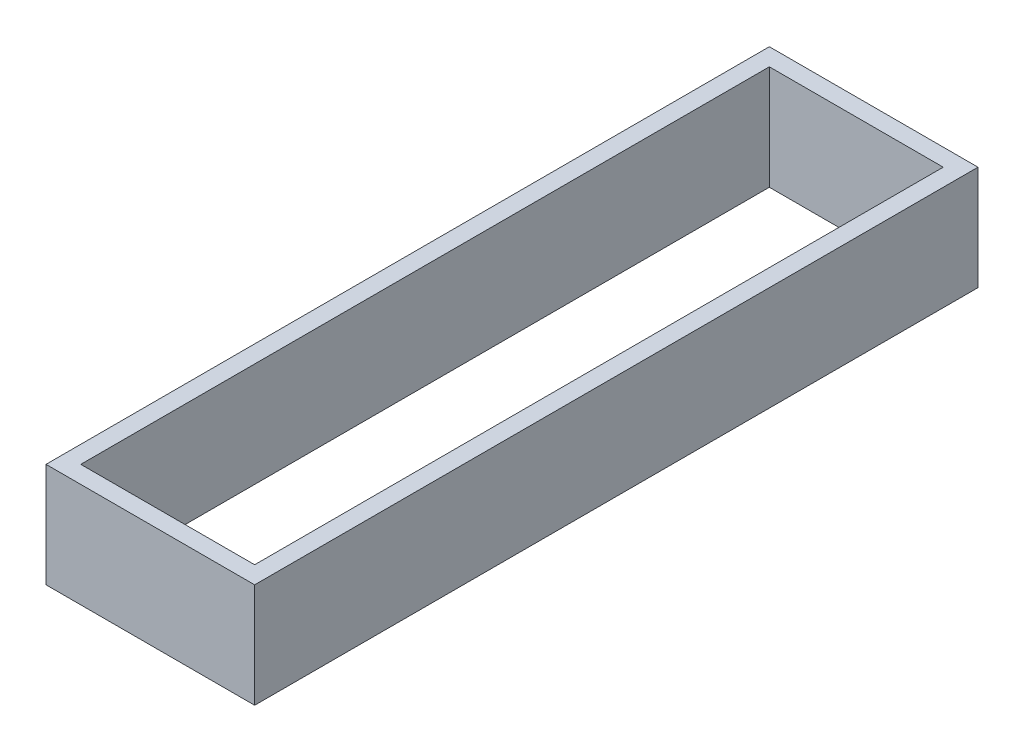
from build123d import *

# Parameters (mm, degrees)
SKETCH_1_W      = 60
SKETCH_1_H      = 208
SKETCH_1_W_2    = 50
SKETCH_1_H_2    = 198
EXTRUDE_1_DEPTH = 30


with BuildPart() as part:
    # ｽｹｯﾁ1 → ﾎﾞｽ - 押し出し1 (new body)
    with BuildSketch(Plane(origin=(0, 0, 0), x_dir=(1, 0, 0), z_dir=(0, 1, 0))):
        Rectangle(SKETCH_1_W, SKETCH_1_H)
        Rectangle(SKETCH_1_W_2, SKETCH_1_H_2, mode=Mode.SUBTRACT)
    extrude(amount=EXTRUDE_1_DEPTH)


solid = part.part
